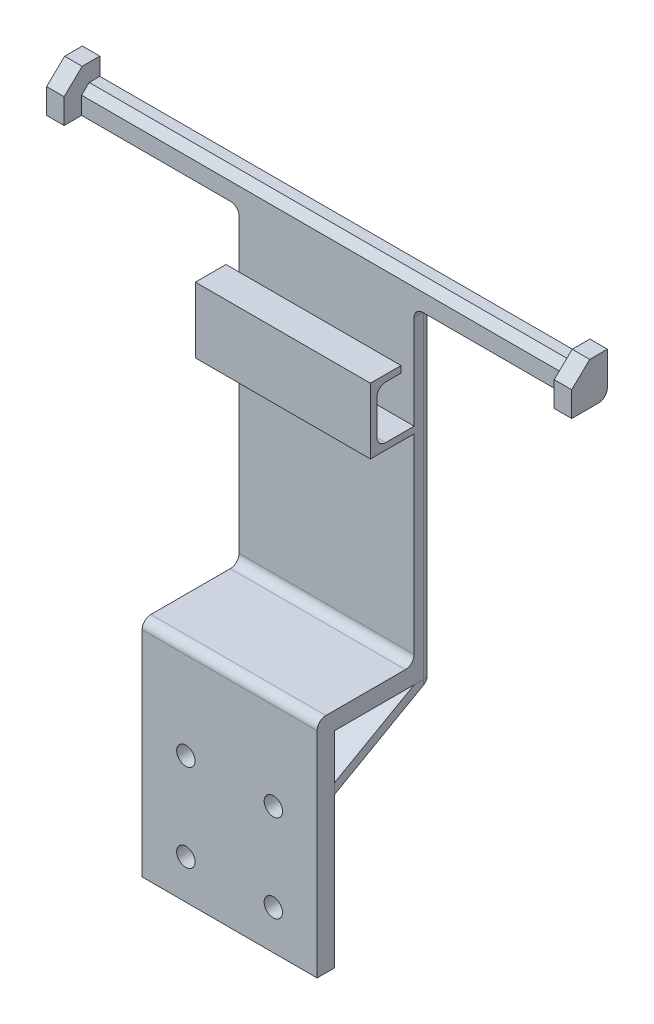
from build123d import *

# Parameters (mm, degrees)
SKETCH_1_W          = 40
SKETCH_1_H          = 35
SKETCH_1_R          = 2.1
EXTRUDE_1_DEPTH     = 4
EXTRUDE_2_DEPTH     = 40
SKETCH_4_W          = 40
SKETCH_4_H          = 4.162308774
EXTRUDE_3_DEPTH     = 56.94
CUT_EXTRUDE_1_DEPTH = 121.357980229
EXTRUDE_4_DEPTH     = 60
EXTRUDE_5_DEPTH     = 4
EXTRUDE_6_DEPTH     = 4
SKETCH_10_W         = 40
SKETCH_10_H         = 15
EXTRUDE_7_DEPTH     = 10
SKETCH_11_W         = 8.5
SKETCH_11_H         = 12
CUT_EXTRUDE_2_DEPTH = 143.100028239
SKETCH_12_W         = 3
SKETCH_12_H         = 1.5
CUT_EXTRUDE_3_DEPTH = 143.100028239
CUT_EXTRUDE_4_DEPTH = 143.100028239
CUT_EXTRUDE_5_DEPTH = 143.100028239
EXTRUDE_10_DEPTH    = 40
SKETCH_19_W         = 4.162308774
SKETCH_19_H         = 5.255395785
CUT_EXTRUDE_6_DEPTH = 143.100028239
EXTRUDE_11_DEPTH    = 40
FILLET_2_R          = 2
FILLET_3_R          = 2
FILLET_4_R          = 2
FILLET_5_R          = 2
CUT_EXTRUDE_7_DEPTH = 106.892734597
FILLET_6_R          = 2


with BuildPart() as part:
    # 草图1 → 凸台-拉伸1 (new body)
    with BuildSketch(Plane.XY):
        with Locations((0, 1.5)):
            Rectangle(SKETCH_1_W, SKETCH_1_H)
        with Locations((-10, 13)):
            Circle(SKETCH_1_R, mode=Mode.SUBTRACT)
        with Locations((-10, -7)):
            Circle(SKETCH_1_R, mode=Mode.SUBTRACT)
        with Locations(Location((10, -7, 0), (0, 0, 180))):
            Circle(SKETCH_1_R, mode=Mode.SUBTRACT)
        with Locations(Location((10, 13, 0), (0, 0, 180))):
            Circle(SKETCH_1_R, mode=Mode.SUBTRACT)
    extrude(amount=EXTRUDE_1_DEPTH)

    # 草图3 → 凸台-拉伸2 (add)
    with BuildSketch(Plane(origin=(20, 0, 0), x_dir=(0, 0, -1), z_dir=(1, 0, 0))):
        Polygon((0, 23.010957881), (-4, 23.010957881), (-4, 19), (0, 19), (22.339641279, 25.6956455), (22.339641279, 54.356827593), (18.177332505, 54.356827593), (18.177332505, 28.459074665), align=None)
    extrude(amount=-EXTRUDE_2_DEPTH)

    # 草图4 → 凸台-拉伸3 (add)
    with BuildSketch(Plane(origin=(0, 54.356827593, 0), x_dir=(1, 0, 0), z_dir=(0, 1, 0))):
        with Locations((0, 20.258486892)):
            Rectangle(SKETCH_4_W, SKETCH_4_H)
    extrude(amount=EXTRUDE_3_DEPTH)

    # 草图5 → 切除-拉伸1 (cut, through all)
    with BuildSketch(Plane(origin=(20, 0, 0), x_dir=(0, 0, -1), z_dir=(1, 0, 0))):
        Polygon((19.907332505, 111.296827593), (18.177332505, 109.636827593), (18.177332505, 111.296827593), align=None)
    extrude(amount=-CUT_EXTRUDE_1_DEPTH, mode=Mode.SUBTRACT)

    # 草图6 → 凸台-拉伸4 (add, symmetric)
    with BuildSketch(Plane(origin=(0, 0, 0), x_dir=(0, 0, -1), z_dir=(1, 0, 0))):
        Polygon((19.907332505, 111.296827593), (22.339641279, 111.296827593), (22.339641279, 105.636827593), (18.177332505, 105.636827593), (18.177332505, 109.636827593), align=None)
    extrude(amount=EXTRUDE_4_DEPTH, both=True)

    # 草图7 → 凸台-拉伸5 (add)
    with BuildSketch(Plane(origin=(60, 0, 0), x_dir=(0, 0, -1), z_dir=(1, 0, 0))):
        Polygon((22.339641279, 115.296827593), (22.339641279, 105.636827593), (14.177332505, 105.636827593), (14.177332505, 111.342267985), (18.29865065, 115.296827593), align=None)
    extrude(amount=-EXTRUDE_5_DEPTH)

    # 草图9 → 凸台-拉伸6 (add)
    with BuildSketch(Plane.ZY.offset(60)):
        Polygon((-22.339641279, 115.296827593), (-22.339641279, 105.636827593), (-14.177332505, 105.636827593), (-14.177332505, 111.342267985), (-18.29865065, 115.296827593), align=None)
    extrude(amount=-EXTRUDE_6_DEPTH)

    # 草图10 → 凸台-拉伸7 (add)
    with BuildSketch(Plane.XY.offset(-18.177332505)):
        with Locations((0, 88.136827593)):
            Rectangle(SKETCH_10_W, SKETCH_10_H)
    extrude(amount=EXTRUDE_7_DEPTH)

    # 草图11 → 切除-拉伸2 (cut, through all)
    with BuildSketch(Plane.ZY.offset(20)):
        with Locations((-13.927332505, 88.136827593)):
            Rectangle(SKETCH_11_W, SKETCH_11_H)
    extrude(amount=-CUT_EXTRUDE_2_DEPTH, mode=Mode.SUBTRACT)

    # 草图12 → 切除-拉伸3 (cut, through all)
    with BuildSketch(Plane.ZY.offset(20)):
        with Locations((-16.677332505, 94.886827593)):
            Rectangle(SKETCH_12_W, SKETCH_12_H)
    extrude(amount=-CUT_EXTRUDE_3_DEPTH, mode=Mode.SUBTRACT)

    # 草图13 → 切除-拉伸4 (cut, through all)
    with BuildSketch(Plane(origin=(20, 0, 0), x_dir=(0, 0, -1), z_dir=(1, 0, 0))):
        Polygon((0, 23.010957881), (0, 19), (18.177332505, 19), (18.177332505, 24.448116784), (18.177332505, 28.459074665), (0, 28.459074665), align=None)
    extrude(amount=-CUT_EXTRUDE_4_DEPTH, mode=Mode.SUBTRACT)


with BuildPart() as cut_extrude_4_piece_1:
    # of the separate pieces the step leaves, piece 1, a body of its own (cut_extrude_4_pieces)
    add(part.part.solids().sort_by_distance((-20, 24.448116784, -18.177332505))[0])

    # 草图14 → 切除-拉伸5 (cut, through all)
    with BuildSketch(Plane(origin=(20, 0, 0), x_dir=(0, 0, -1), z_dir=(1, 0, 0))):
        Polygon((22.339641279, 25.6956455), (18.177332505, 25.6956455), (18.177332505, 24.448116784), align=None)
    extrude(amount=-CUT_EXTRUDE_5_DEPTH, mode=Mode.SUBTRACT)



with BuildPart() as cut_extrude_4_piece_2:
    # of the separate pieces the step leaves, piece 2, a body of its own (cut_extrude_4_pieces)
    add(part.part.solids().sort_by_distance((-20, -16, 0))[0])


with BuildPart() as cut_extrude_4_piece_1_1:
    add(cut_extrude_4_piece_1.part)

    add(cut_extrude_4_piece_2.part)  # 凸台-拉伸10 merges 切除-拉伸4 piece 2
    # 草图18 → 凸台-拉伸10 (add)
    with BuildSketch(Plane(origin=(20, 0, 0), x_dir=(0, 0, -1), z_dir=(1, 0, 0))):
        Polygon((-4, 23.010957881), (-4, 34.951041285), (22.339641279, 34.951041285), (22.339641279, 30.951041285), (0, 30.951041285), (0, 23.010957881), align=None)
    extrude(amount=-EXTRUDE_10_DEPTH)

    # 草图19 → 切除-拉伸6 (cut, through all)
    with BuildSketch(Plane(origin=(20, 0, 0), x_dir=(0, 0, -1), z_dir=(1, 0, 0))):
        with Locations((20.258486892, 28.323343392)):
            Rectangle(SKETCH_19_W, SKETCH_19_H)
    extrude(amount=-CUT_EXTRUDE_6_DEPTH, mode=Mode.SUBTRACT)

    # 圆角2
    fillet_2_edges = [cut_extrude_4_piece_1_1.edges().sort_by_distance(p)[0] for p in [
        (0, 34.951041285, 4),
    ]]
    fillet(fillet_2_edges, radius=FILLET_2_R)

    # 圆角3
    fillet_3_edges = [cut_extrude_4_piece_1_1.edges().sort_by_distance(p)[0] for p in [
        (0, 34.951041285, -18.177332505),
    ]]
    fillet(fillet_3_edges, radius=FILLET_3_R)

    # 圆角4
    fillet_4_edges = [cut_extrude_4_piece_1_1.edges().sort_by_distance(p)[0] for p in [
        (20, 105.636827593, -20.258486892),
        (-20, 105.636827593, -20.258486892),
    ]]
    fillet(fillet_4_edges, radius=FILLET_4_R)

    # 圆角5
    fillet_5_edges = [cut_extrude_4_piece_1_1.edges().sort_by_distance(p)[0] for p in [
        (41, 105.636827593, -22.339641279),
        (20, 67.293934439, -22.339641279),
        (-20, 67.293934439, -22.339641279),
        (-41, 105.636827593, -22.339641279),
        (-20.585786438, 105.051041156, -22.339641279),
        (20.585786438, 105.051041156, -22.339641279),
    ]]
    fillet(fillet_5_edges, radius=FILLET_5_R)

    # 圆角6
    fillet_6_edges = [cut_extrude_4_piece_1_1.edges().sort_by_distance(p)[0] for p in [
        (0, 94.136827593, -9.677332505),
        (0, 82.136827593, -9.677332505),
    ]]
    fillet(fillet_6_edges, radius=FILLET_6_R)


with BuildPart() as body_2:
    # 草图20 → 凸台-拉伸11 (new body)
    with BuildSketch(Plane(origin=(20, 0, 0), x_dir=(0, 0, -1), z_dir=(1, 0, 0))):
        Polygon((22.339641279, 30.951041285), (0, 18.325146666), (0, 20.677595897), (18.177332505, 30.951041285), align=None)
    extrude(amount=-EXTRUDE_11_DEPTH)

    # 草图21 → 切除-拉伸7 (cut, through all)
    with BuildSketch(Plane(origin=(0, 30.951041285, 0), x_dir=(1, 0, 0), z_dir=(0, 1, 0))):
        with BuildLine():
            Line((-20, 22.339641279), (-20, 20.339641279))
            ThreePointArc((-20, 20.339641279), (-19.414213562, 21.753854841), (-18, 22.339641279))
            Line((-18, 22.339641279), (-20, 22.339641279))
        make_face()
        with BuildLine():
            Line((20, 22.339641279), (18, 22.339641279))
            ThreePointArc((18, 22.339641279), (19.414213562, 21.753854841), (20, 20.339641279))
            Line((20, 20.339641279), (20, 22.339641279))
        make_face()
    extrude(amount=-CUT_EXTRUDE_7_DEPTH, mode=Mode.SUBTRACT)


solid = Compound([cut_extrude_4_piece_1_1.part, body_2.part])
